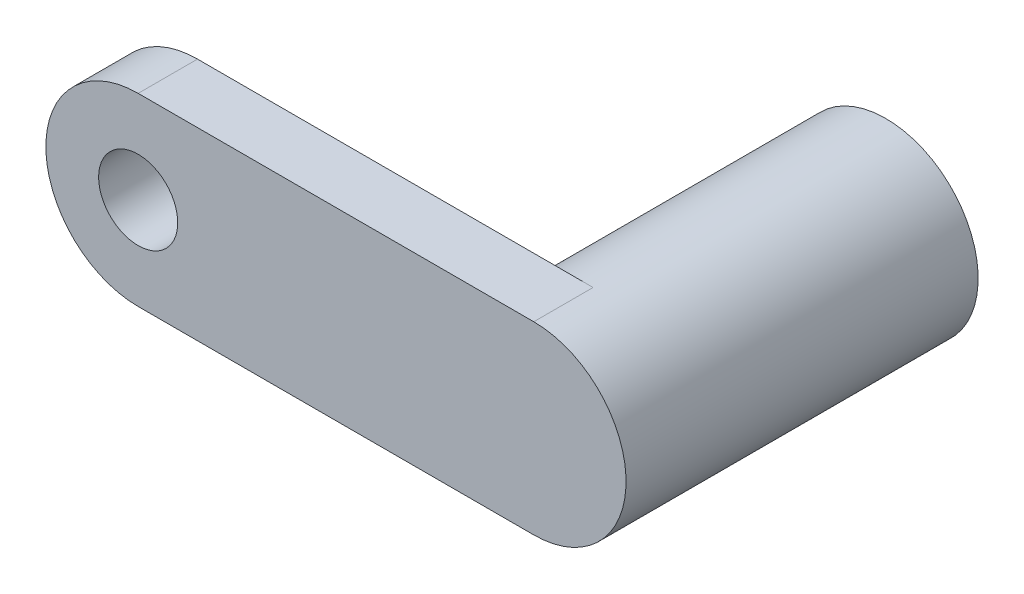
from build123d import *

# Parameters (mm, degrees)
BOSS_EXTRU_1_DEPTH                  = 4.5
BOSS_EXTRU_2_START                  = 22.2
ESQUISSE2_R                         = 7
BOSS_EXTRU_2_DEPTH                  = 22.2
DIAM_TRE_DU_PER_AGE_4_2_4_2_1_D     = 4.2
DIAM_TRE_DU_PER_AGE_4_2_4_2_1_DEPTH = 10
DIAM_TRE_DU_PER_AGE_6_0_6_1_D       = 6


with BuildPart() as part:
    # Esquisse1 → Boss.-Extru.1 (new body)
    with BuildSketch(Plane(origin=(0, 0, 0), x_dir=(-1, 0, 0), z_dir=(0, 0, -1))):
        with BuildLine():
            Line((0, 7), (-30, 7))
            ThreePointArc((-30, 7), (-37, 0), (-30, -7))
            Line((-30, -7), (0, -7))
            ThreePointArc((0, -7), (7, 0), (0, 7))
        make_face()
    extrude(amount=-BOSS_EXTRU_1_DEPTH)

    # Esquisse2 → Boss.-Extru.2 (add)
    with BuildSketch(Plane(origin=(0, 0, 0), x_dir=(-1, 0, 0), z_dir=(0, 0, -1)).offset(BOSS_EXTRU_2_START)):
        with Locations((-30, 0)):
            Circle(ESQUISSE2_R)
    extrude(amount=-BOSS_EXTRU_2_DEPTH)

    # Diamètre du perçage Ø4.2 (4.2)1
    with Locations(Plane(origin=(0, 0, -22.2), x_dir=(-1, 0, 0), z_dir=(0, 0, -1))):
        with Locations((-30, 0)):
            Hole(DIAM_TRE_DU_PER_AGE_4_2_4_2_1_D / 2, depth=DIAM_TRE_DU_PER_AGE_4_2_4_2_1_DEPTH)

    # Diamètre du perçage Ø6.0 (6)1 (through all)
    with Locations(Plane(origin=(0, 0, 0), x_dir=(-1, 0, 0), z_dir=(0, 0, -1))):
        with Locations((0, 0)):
            Hole(DIAM_TRE_DU_PER_AGE_6_0_6_1_D / 2)


solid = part.part
